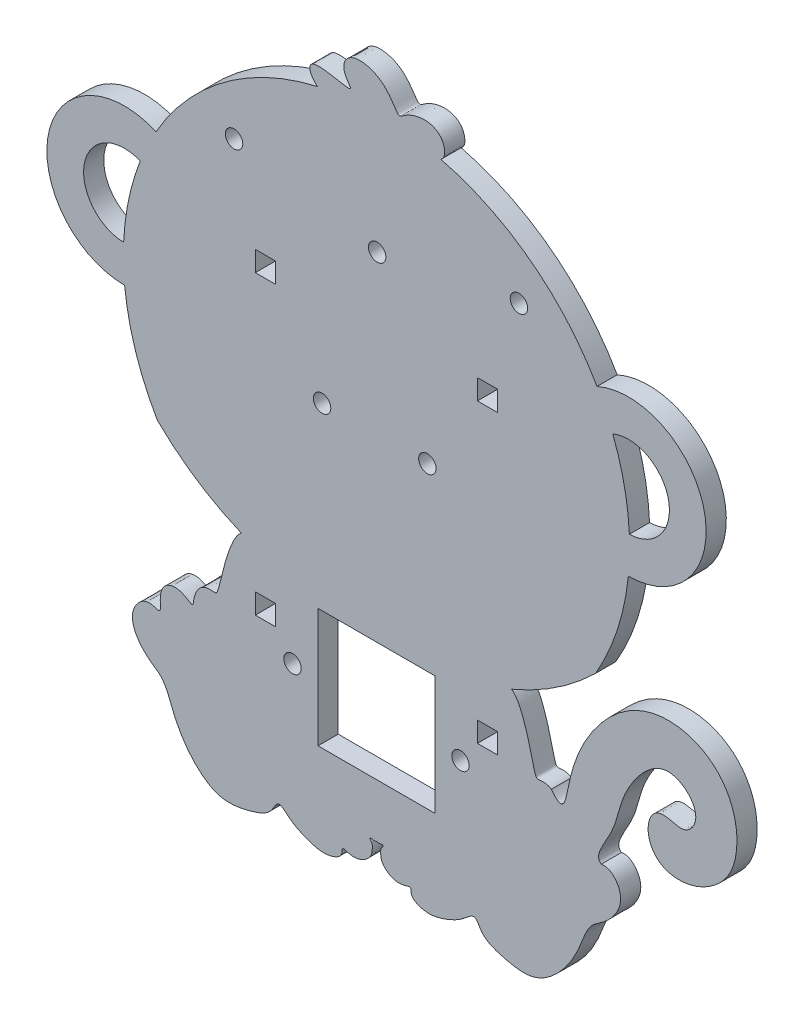
from build123d import *

# Parameters (mm, degrees)
MODEL_R             = 2.05
MODEL_W             = 4.75
MODEL_H             = 4.75
BOSS_EXTRUDE1_DEPTH = 4.75


with BuildPart() as part:
    # Model → Boss-Extrude1 (new body)
    # profile 1 of 10: a face of its own
    with BuildSketch(Plane.XY):
        with BuildLine():
            ThreePointArc((-295.53920269, 433.095020448), (-282.608650806, 438.430402071), (-277.24978825, 451.351240325))
            ThreePointArc((-277.24978825, 451.351240325), (-285.554772518, 466.656892039), (-302.913653982, 468.037099404))
            ThreePointArc((-302.913653982, 468.037099404), (-300.915846738, 464.202061949), (-299.205795948, 460.23035295))
            ThreePointArc((-299.205795948, 460.23035295), (-290.170377358, 459.354837696), (-285.886950557, 451.351240325))
            ThreePointArc((-285.886950557, 451.351240325), (-288.632642257, 444.621955402), (-295.302245857, 441.734311673))
            ThreePointArc((-295.302245857, 441.734311673), (-295.261502258, 437.410298949), (-295.53920269, 433.095020448))
        make_face()
    # profile 2 of 10: a face of its own
    with BuildSketch(Plane.XY):
        with BuildLine():
            ThreePointArc((-299.205795948, 460.23035295), (-300.915846738, 464.202061949), (-302.913653982, 468.037099404))
            ThreePointArc((-302.913653982, 468.037099404), (-313.368807432, 447.58134096), (-295.53920269, 433.095020448))
            ThreePointArc((-295.53920269, 433.095020448), (-295.261502258, 437.410298949), (-295.302245857, 441.734311673))
            ThreePointArc((-295.302245857, 441.734311673), (-304.917803711, 449.364907283), (-299.205795948, 460.23035295))
        make_face()
    # profile 3 of 10: a face of its own
    with BuildSketch(Plane.XY):
        with BuildLine():
            ThreePointArc((-295.53920269, 433.095020448), (-313.368807432, 447.58134096), (-302.913653982, 468.037099404))
            ThreePointArc((-302.913653982, 468.037099404), (-318.490243046, 485.80537303), (-339.811140885, 495.991686882))
            ThreePointArc((-339.811140885, 495.991686882), (-347.238992057, 497.333297382), (-354.777593989, 497.710620444))
            ThreePointArc((-354.777593989, 497.710620444), (-361.756537627, 497.394857379), (-368.648535438, 496.252173352))
            ThreePointArc((-368.648535438, 496.252173352), (-390.614540969, 486.143224047), (-406.641533995, 468.037099404))
            ThreePointArc((-406.641533995, 468.037099404), (-398.743498013, 461.302506057), (-395.792899727, 451.351240325))
            ThreePointArc((-395.792899727, 451.351240325), (-401.128311473, 438.453852881), (-414.015985287, 433.095020448))
            ThreePointArc((-414.015985287, 433.095020448), (-411.431056442, 420.844790734), (-406.306877408, 409.421447336))
            ThreePointArc((-406.306877408, 409.421447336), (-397.05642145, 401.927835806), (-386.551251239, 396.327251189))
            ThreePointArc((-386.551251239, 396.327251189), (-370.945172765, 392.102760227), (-354.777593989, 392.029236712))
            ThreePointArc((-354.777593989, 392.029236712), (-338.610015212, 392.102760227), (-323.003936738, 396.327251189))
            ThreePointArc((-323.003936738, 396.327251189), (-312.498766528, 401.927835806), (-303.24831057, 409.421447336))
            ThreePointArc((-303.24831057, 409.421447336), (-298.124131535, 420.844790734), (-295.53920269, 433.095020448))
        make_face()
        with Locations((-367.578065783, 432.289888386)):
            Circle(MODEL_R, mode=Mode.SUBTRACT)
        with Locations((-380.902593989, 453.404236712)):
            Rectangle(MODEL_W, MODEL_H, mode=Mode.SUBTRACT)
        with Locations((-388.277593989, 475.779236712)):
            Circle(MODEL_R, mode=Mode.SUBTRACT)
        with Locations((-354.619244966, 469.543613637)):
            Circle(MODEL_R, mode=Mode.SUBTRACT)
        with Locations((-342.813199123, 432.371155303)):
            Circle(MODEL_R, mode=Mode.SUBTRACT)
        with Locations((-328.652593989, 453.404236712)):
            Rectangle(MODEL_W, MODEL_H, mode=Mode.SUBTRACT)
        with Locations((-321.277593989, 475.779236712)):
            Circle(MODEL_R, mode=Mode.SUBTRACT)
    # profile 4 of 10: a face of its own
    with BuildSketch(Plane.XY):
        with BuildLine():
            ThreePointArc((-295.302245857, 441.734311673), (-296.504545624, 451.140507471), (-299.205795948, 460.23035295))
            ThreePointArc((-299.205795948, 460.23035295), (-304.917803711, 449.364907283), (-295.302245857, 441.734311673))
        make_face()
    # profile 5 of 10: a face of its own
    with BuildSketch(Plane.XY):
        with BuildLine():
            ThreePointArc((-354.777593989, 497.710620444), (-347.238992057, 497.333297382), (-339.811140885, 495.991686882))
            add(Edge.make_bspline(
                [(-368.648535438, 496.252173352), (-368.744458236, 496.318852064), (-368.933155722, 496.46135137), (-369.206763211, 496.702529524), (-369.552638711, 497.078952875), (-369.945448044, 497.635151945), (-370.27396009, 498.258937778), (-370.49029081, 498.914952019), (-370.51070775, 499.541563445), (-370.238365938, 500.064302422), (-369.5990972, 500.417471707), (-368.57162488, 500.562380095), (-367.22355688, 500.508813977), (-365.687080465, 500.304348965), (-364.130399482, 500.021394498), (-362.730437113, 499.744991582), (-361.645780778, 499.560560003), (-360.987783845, 499.541133492), (-360.796409046, 499.736067669), (-361.003653893, 500.155847055), (-361.456239643, 500.775355547), (-361.969645158, 501.546412025), (-362.368346783, 502.406968262), (-362.540769792, 503.292531993), (-362.454363932, 504.143316727), (-362.127001431, 504.906996063), (-361.609010526, 505.54285956), (-360.962354705, 506.024792223), (-360.237689537, 506.346315269), (-359.465109655, 506.519028644), (-358.662050204, 506.563781119), (-357.836770513, 506.503364206), (-356.993360104, 506.355416269), (-356.136711355, 506.123246396), (-355.27524615, 505.794703449), (-354.419874931, 505.352916652), (-353.583850229, 504.783872945), (-352.782377599, 504.085819177), (-352.032065864, 503.276653785), (-351.351103862, 502.405268117), (-350.756796891, 501.550400765), (-350.259062752, 500.800910062), (-349.854900796, 500.240489256), (-349.52240587, 499.930593307), (-349.215031159, 499.894076524), (-348.855526802, 500.098537748), (-348.362085472, 500.475509867), (-347.67170771, 500.938251599), (-346.770031422, 501.402187782), (-345.688786994, 501.792289415), (-344.48987856, 502.045099565), (-343.253856136, 502.112491058), (-342.066559862, 501.964757688), (-341.006667622, 501.593968073), (-340.132609258, 501.01739116), (-339.470394525, 500.280534755), (-339.021946768, 499.447136213), (-338.772548612, 498.589873373), (-338.698846344, 497.780410896), (-338.775989921, 497.080683391), (-338.986639614, 496.531262609), (-339.255348506, 496.227388525), (-339.511863577, 496.0787419), (-339.707309513, 496.014838841), (-339.811140885, 495.991686882)],
                knots=[0, 0, 0, 0, 0, 0, 0.016666667, 0.033333333, 0.05, 0.066666667, 0.083333333, 0.1, 0.116666667, 0.133333333, 0.15, 0.166666667, 0.183333333, 0.2, 0.216666667, 0.233333333, 0.25, 0.266666667, 0.283333333, 0.3, 0.316666667, 0.333333333, 0.35, 0.366666667, 0.383333333, 0.4, 0.416666667, 0.433333333, 0.45, 0.466666667, 0.483333333, 0.5, 0.516666667, 0.533333333, 0.55, 0.566666667, 0.583333333, 0.6, 0.616666667, 0.633333333, 0.65, 0.666666667, 0.683333333, 0.7, 0.716666667, 0.733333333, 0.75, 0.766666667, 0.783333333, 0.8, 0.816666667, 0.833333333, 0.85, 0.866666667, 0.883333333, 0.9, 0.916666667, 0.933333333, 0.95, 0.966666667, 0.983333333, 1, 1, 1, 1, 1, 1], degree=5))
            ThreePointArc((-368.648535438, 496.252173352), (-361.756537627, 497.394857379), (-354.777593989, 497.710620444))
        make_face()
    # profile 6 of 10: a face of its own
    with BuildSketch(Plane.XY):
        with BuildLine():
            add(Edge.make_bspline(
                [(-323.003936738, 396.327251189), (-322.639135583, 396.079204413), (-322.18920374, 395.634433922), (-321.658390696, 394.898644088), (-321.051857816, 393.757203334), (-320.383735374, 392.131003368), (-319.977262023, 391.014654975), (-319.584917193, 389.819275468), (-319.135868658, 388.323421516), (-318.721860717, 386.804935246), (-318.353600889, 385.34636593), (-318.038508773, 384.035346949), (-317.773489578, 382.944281063), (-317.579832511, 382.209449772), (-317.401157087, 381.664820315), (-317.218450591, 381.31109681), (-317.003689416, 381.129911234), (-316.721708308, 381.082225409), (-316.343707995, 381.115525432), (-315.861762853, 381.169472404), (-315.293993546, 381.182617586), (-314.716438841, 381.105097359), (-314.256472836, 380.951412883), (-313.932453608, 380.783648044), (-313.737120758, 380.657216991), (-313.6607794, 380.60362174)],
                knots=[0, 0, 0, 0, 0, 0, 0.02, 0.025, 0.03, 0.035, 0.04, 0.045, 0.05, 0.06, 0.065, 0.07, 0.075, 0.08, 0.085, 0.09, 0.095, 0.1, 0.105, 0.11, 0.115, 0.12, 0.123294018, 0.123294018, 0.123294018, 0.123294018, 0.123294018, 0.123294018], degree=5))
            ThreePointArc((-323.003936738, 396.327251189), (-338.610015212, 392.102760227), (-354.777593989, 392.029236712))
            ThreePointArc((-354.777593989, 392.029236712), (-370.945172765, 392.102760227), (-386.551251239, 396.327251189))
            add(Edge.make_bspline(
                [(-386.551251239, 396.327251189), (-386.916052394, 396.079204413), (-387.365984237, 395.634433922), (-387.896797281, 394.898644088), (-388.503330161, 393.757203334), (-389.171452603, 392.131003368), (-389.577925954, 391.014654975), (-389.970270784, 389.819275468), (-390.419319319, 388.323421516), (-390.83332726, 386.804935246), (-391.201587088, 385.34636593), (-391.516679205, 384.035346949), (-391.781698399, 382.944281063), (-391.975355466, 382.209449772), (-392.15403089, 381.664820315), (-392.336737386, 381.31109681), (-392.551498562, 381.129911234), (-392.833479669, 381.082225409), (-393.211479982, 381.115525432), (-393.693425125, 381.169472404), (-394.261194431, 381.182617586), (-394.881047474, 381.099420015), (-395.510435114, 380.877573231), (-396.105936728, 380.494485307), (-396.631517428, 379.95585235), (-397.063963964, 379.297531395), (-397.39210439, 378.573969962), (-397.617276013, 377.849585475), (-397.753517497, 377.188797135), (-397.82736951, 376.647023839), (-397.879059879, 376.260334721), (-397.959633552, 376.038465419), (-398.114782848, 375.972462073), (-398.366034123, 376.040823891), (-398.706936261, 376.21469148), (-399.120091801, 376.460086445), (-399.591458011, 376.741171495), (-400.117952431, 377.022315753), (-400.699774201, 377.268862798), (-401.463798734, 377.484035353), (-402.300244633, 377.553822048), (-403.174091852, 377.426716269), (-404.002173047, 377.065864722), (-404.698224792, 376.46441147), (-405.153470998, 375.811835942), (-405.461269956, 375.032169593), (-405.619922332, 374.166940367), (-405.657953521, 373.27889911), (-405.626485489, 372.442499072), (-405.587522811, 371.731075977), (-405.603727217, 371.205296174), (-405.727364814, 370.900755869), (-405.990085682, 370.81668236), (-406.39105056, 370.902146782), (-406.905602715, 371.07475403), (-407.496249881, 371.243305804), (-408.122207542, 371.327500075), (-408.751072773, 371.282728006), (-409.35960202, 371.097539496), (-409.931191749, 370.782809916), (-410.454421679, 370.36348433), (-410.921225043, 369.869653892), (-411.325051593, 369.32694511), (-411.659572418, 368.750331411), (-411.919102239, 368.147846593), (-412.098696202, 367.522400938), (-412.194371621, 366.874422897), (-412.203287138, 366.20397783), (-412.092164868, 365.237355517), (-411.795780763, 364.240492853), (-411.25356719, 363.0979097), (-410.505546493, 362.004000685), (-409.628552466, 361.020862692), (-408.940714048, 360.363039305), (-408.261699769, 359.795455705), (-407.719269628, 359.383631865), (-407.21381394, 359.028246689), (-406.753242924, 358.71792316), (-406.337217025, 358.432587935), (-405.958407604, 358.146100067), (-405.606436892, 357.832150323), (-405.270933307, 357.469037169), (-404.945150571, 357.045248498), (-404.628769556, 356.563710073), (-404.325203667, 356.036561227), (-404.039420225, 355.480831591), (-403.775511082, 354.913678765), (-403.486293011, 354.234906798), (-403.22438966, 353.563780813), (-402.971971356, 352.893055429), (-402.704512752, 352.203026621), (-402.401681187, 351.478012783), (-402.062584898, 350.721085445), (-401.674639208, 349.927966936), (-401.239024686, 349.111007443), (-400.763113802, 348.289788183), (-400.254340005, 347.481959495), (-399.722634495, 346.692998852), (-399.163365939, 345.932140679), (-398.574323946, 345.19923963), (-397.949478676, 344.488835597), (-397.28186749, 343.797089708), (-396.693729261, 343.232918759), (-395.94666487, 342.573889335), (-395.145878925, 341.947793479), (-394.290902186, 341.375211916), (-393.384167186, 340.882126765), (-392.430043668, 340.491703263), (-391.606002687, 340.243986907), (-390.756002743, 340.079446261), (-389.883129061, 339.998262902), (-388.990604918, 339.995014447), (-388.082210988, 340.060658996), (-387.162607569, 340.183979577), (-386.237707408, 340.353267946), (-385.315001235, 340.557855636), (-384.403963907, 340.789827334), (-383.516286063, 341.045384095), (-382.66652457, 341.327024633), (-381.871318875, 341.642937555), (-381.146754324, 342.002777686), (-380.506140062, 342.414272763), (-379.957720387, 342.879646699), (-379.50217975, 343.391768319), (-379.130782998, 343.931240964), (-378.821858803, 344.461005534), (-378.544703377, 344.932108886), (-378.267774642, 345.29593373), (-377.965518245, 345.51436395), (-377.625879138, 345.570992742), (-377.257148561, 345.481328236), (-376.875804119, 345.278776475), (-376.496250149, 345.00253689), (-376.11706805, 344.682307942), (-375.720845967, 344.335154988), (-375.283150649, 343.970625574), (-374.779103973, 343.593551859), (-374.190278948, 343.207542556), (-373.377688666, 342.741091189), (-372.449841911, 342.284943077), (-371.448923671, 341.861784637), (-370.434447105, 341.496921291), (-369.457107924, 341.211628122), (-368.685864943, 341.035221995), (-367.964373903, 340.924859402), (-367.285516994, 340.881136877), (-366.635919607, 340.902071878), (-366.001452121, 340.984188477), (-365.373937537, 341.123915256), (-364.75630659, 341.318535957), (-364.170945702, 341.568094094), (-363.657947564, 341.87428189), (-363.258368215, 342.235110671), (-362.999601239, 342.639822419), (-362.882834785, 343.065290294), (-362.862380856, 343.467877411), (-362.860328863, 343.794256059), (-362.800804618, 344.002021381), (-362.645316427, 344.082202864), (-362.403915174, 344.064482859), (-362.091030238, 343.983757423), (-361.712216892, 343.868949898), (-361.271123238, 343.746963048), (-360.772201451, 343.643387937), (-360.225145899, 343.584551667), (-359.643851104, 343.593953505), (-359.045609545, 343.68889199), (-358.331130904, 343.914571841), (-357.653031997, 344.271758954), (-357.055699253, 344.71601695), (-356.577458743, 345.17871164), (-356.233391408, 345.621031596), (-356.033125086, 345.975351534), (-355.902737419, 346.342883089), (-355.820827463, 346.757252518), (-355.769760706, 347.236551212), (-355.745106949, 347.759570584), (-355.762413964, 348.248781386), (-355.838587496, 348.623368474), (-355.977712536, 348.837568218), (-356.150848594, 348.941800594), (-356.292732028, 349.075710758), (-356.33646563, 349.288102762), (-356.236344626, 349.443149765), (-355.997125235, 349.455364951), (-355.677539018, 349.382302231), (-355.345578077, 349.318848286), (-355.1000792, 349.319880609), (-354.932396923, 349.356987082), (-354.827970147, 349.397996872), (-354.777593989, 349.422562594)],
                knots=[0, 0, 0, 0, 0, 0, 0.02, 0.025, 0.03, 0.035, 0.04, 0.045, 0.05, 0.06, 0.065, 0.07, 0.075, 0.08, 0.085, 0.09, 0.095, 0.1, 0.105, 0.11, 0.115, 0.12, 0.125, 0.13, 0.135, 0.14, 0.145, 0.15, 0.155, 0.16, 0.165, 0.17, 0.175, 0.18, 0.185, 0.19, 0.195, 0.2, 0.205, 0.21, 0.22, 0.225, 0.23, 0.235, 0.24, 0.245, 0.25, 0.255, 0.26, 0.265, 0.27, 0.275, 0.28, 0.285, 0.29, 0.295, 0.3, 0.305, 0.31, 0.315, 0.32, 0.325, 0.33, 0.335, 0.34, 0.345, 0.35, 0.355, 0.36, 0.375, 0.38, 0.39, 0.395, 0.4, 0.405, 0.41, 0.415, 0.42, 0.425, 0.43, 0.435, 0.44, 0.445, 0.45, 0.455, 0.46, 0.465, 0.47, 0.48, 0.485, 0.49, 0.495, 0.5, 0.51, 0.515, 0.52, 0.525, 0.53, 0.54, 0.545, 0.55, 0.555, 0.56, 0.565, 0.575, 0.58, 0.585, 0.59, 0.595, 0.6, 0.605, 0.61, 0.615, 0.62, 0.625, 0.63, 0.635, 0.64, 0.645, 0.65, 0.655, 0.66, 0.665, 0.67, 0.675, 0.68, 0.685, 0.69, 0.695, 0.7, 0.705, 0.71, 0.715, 0.72, 0.725, 0.73, 0.735, 0.74, 0.745, 0.755, 0.76, 0.765, 0.77, 0.775, 0.78, 0.785, 0.79, 0.795, 0.8, 0.805, 0.81, 0.815, 0.82, 0.825, 0.83, 0.835, 0.84, 0.845, 0.85, 0.855, 0.86, 0.865, 0.87, 0.875, 0.88, 0.885, 0.89, 0.895, 0.905, 0.91, 0.915, 0.92, 0.925, 0.93, 0.935, 0.94, 0.945, 0.95, 0.955, 0.96, 0.965, 0.97, 0.975, 0.98, 0.985, 0.99, 0.995, 1, 1, 1, 1, 1, 1], degree=5))
            add(Edge.make_bspline(
                [(-301.898947089, 371.249991702), (-301.80670497, 371.265018138), (-301.589974955, 371.293910279), (-301.244905456, 371.313674079), (-300.773941346, 371.273545454), (-300.195585957, 371.097539496), (-299.623996228, 370.782809916), (-299.100766299, 370.36348433), (-298.633962934, 369.869653892), (-298.230136384, 369.32694511), (-297.89561556, 368.750331411), (-297.636085738, 368.147846593), (-297.456491776, 367.522400938), (-297.360816357, 366.874422897), (-297.35190084, 366.20397783), (-297.463023109, 365.237355517), (-297.759407215, 364.240492853), (-298.301620787, 363.0979097), (-299.049641484, 362.004000685), (-299.926635511, 361.020862692), (-300.61447393, 360.363039305), (-301.293488209, 359.795455705), (-301.83591835, 359.383631865), (-302.341374037, 359.028246689), (-302.801945054, 358.71792316), (-303.217970952, 358.432587935), (-303.596780374, 358.146100067), (-303.948751085, 357.832150323), (-304.28425467, 357.469037169), (-304.610037406, 357.045248498), (-304.926418421, 356.563710073), (-305.22998431, 356.036561227), (-305.515767753, 355.480831591), (-305.779676896, 354.913678765), (-306.068894967, 354.234906798), (-306.330798317, 353.563780813), (-306.583216622, 352.893055429), (-306.850675225, 352.203026621), (-307.15350679, 351.478012783), (-307.492603079, 350.721085445), (-307.88054877, 349.927966936), (-308.316163291, 349.111007443), (-308.792074176, 348.289788183), (-309.300847972, 347.481959495), (-309.832553482, 346.692998852), (-310.391822039, 345.932140679), (-310.980864031, 345.19923963), (-311.605709301, 344.488835597), (-312.273320488, 343.797089708), (-312.861458716, 343.232918759), (-313.608523108, 342.573889335), (-314.409309053, 341.947793479), (-315.264285791, 341.375211916), (-316.171020791, 340.882126765), (-317.125144309, 340.491703263), (-317.949185291, 340.243986907), (-318.799185234, 340.079446261), (-319.672058916, 339.998262902), (-320.564583059, 339.995014447), (-321.472976989, 340.060658996), (-322.392580408, 340.183979577), (-323.31748057, 340.353267946), (-324.240186742, 340.557855636), (-325.151224071, 340.789827334), (-326.038901914, 341.045384095), (-326.888663407, 341.327024633), (-327.683869103, 341.642937555), (-328.408433654, 342.002777686), (-329.049047915, 342.414272763), (-329.59746759, 342.879646699), (-330.053008227, 343.391768319), (-330.42440498, 343.931240964), (-330.733329174, 344.461005534), (-331.0104846, 344.932108886), (-331.287413335, 345.29593373), (-331.589669732, 345.51436395), (-331.929308839, 345.570992742), (-332.298039416, 345.481328236), (-332.679383858, 345.278776475), (-333.058937829, 345.00253689), (-333.438119927, 344.682307942), (-333.83434201, 344.335154988), (-334.272037329, 343.970625574), (-334.776084004, 343.593551859), (-335.364909029, 343.207542556), (-336.177499311, 342.741091189), (-337.105346067, 342.284943077), (-338.106264306, 341.861784637), (-339.120740873, 341.496921291), (-340.098080053, 341.211628122), (-340.869323035, 341.035221995), (-341.590814074, 340.924859402), (-342.269670984, 340.881136877), (-342.91926837, 340.902071878), (-343.553735856, 340.984188477), (-344.18125044, 341.123915256), (-344.798881387, 341.318535957), (-345.384242276, 341.568094094), (-345.897240413, 341.87428189), (-346.296819762, 342.235110671), (-346.555586738, 342.639822419), (-346.672353193, 343.065290294), (-346.692807122, 343.467877411), (-346.694859114, 343.794256059), (-346.754383359, 344.002021381), (-346.909871551, 344.082202864), (-347.151272803, 344.064482859), (-347.46415774, 343.983757423), (-347.842971085, 343.868949898), (-348.284064739, 343.746963048), (-348.782986526, 343.643387937), (-349.330042079, 343.584551667), (-349.911336873, 343.593953505), (-350.509578433, 343.68889199), (-351.224057074, 343.914571841), (-351.902155981, 344.271758954), (-352.499488725, 344.71601695), (-352.977729235, 345.17871164), (-353.321796569, 345.621031596), (-353.522062892, 345.975351534), (-353.652450559, 346.342883089), (-353.734360514, 346.757252518), (-353.785427271, 347.236551212), (-353.810081029, 347.759570584), (-353.792774013, 348.248781386), (-353.716600481, 348.623368474), (-353.577475441, 348.837568218), (-353.404339383, 348.941800594), (-353.262455949, 349.075710758), (-353.218722348, 349.288102762), (-353.318843352, 349.443149765), (-353.558062742, 349.455364951), (-353.87764896, 349.382302231), (-354.2096099, 349.318848286), (-354.455108777, 349.319880609), (-354.622791055, 349.356987082), (-354.727217831, 349.397996872), (-354.777593989, 349.422562594)],
                knots=[0.291239622, 0.291239622, 0.291239622, 0.291239622, 0.291239622, 0.291239622, 0.295, 0.3, 0.305, 0.31, 0.315, 0.32, 0.325, 0.33, 0.335, 0.34, 0.345, 0.35, 0.355, 0.36, 0.375, 0.38, 0.39, 0.395, 0.4, 0.405, 0.41, 0.415, 0.42, 0.425, 0.43, 0.435, 0.44, 0.445, 0.45, 0.455, 0.46, 0.465, 0.47, 0.48, 0.485, 0.49, 0.495, 0.5, 0.51, 0.515, 0.52, 0.525, 0.53, 0.54, 0.545, 0.55, 0.555, 0.56, 0.565, 0.575, 0.58, 0.585, 0.59, 0.595, 0.6, 0.605, 0.61, 0.615, 0.62, 0.625, 0.63, 0.635, 0.64, 0.645, 0.65, 0.655, 0.66, 0.665, 0.67, 0.675, 0.68, 0.685, 0.69, 0.695, 0.7, 0.705, 0.71, 0.715, 0.72, 0.725, 0.73, 0.735, 0.74, 0.745, 0.755, 0.76, 0.765, 0.77, 0.775, 0.78, 0.785, 0.79, 0.795, 0.8, 0.805, 0.81, 0.815, 0.82, 0.825, 0.83, 0.835, 0.84, 0.845, 0.85, 0.855, 0.86, 0.865, 0.87, 0.875, 0.88, 0.885, 0.89, 0.895, 0.905, 0.91, 0.915, 0.92, 0.925, 0.93, 0.935, 0.94, 0.945, 0.95, 0.955, 0.96, 0.965, 0.97, 0.975, 0.98, 0.985, 0.99, 0.995, 1, 1, 1, 1, 1, 1], degree=5))
            add(Edge.make_bspline(
                [(-312.570027786, 379.374371389), (-312.559271777, 379.355886568), (-312.470544427, 379.20149493), (-312.316103558, 378.902890391), (-312.124199573, 378.448878813), (-311.937911965, 377.849585475), (-311.80167048, 377.188797135), (-311.727818467, 376.647023839), (-311.676128098, 376.260334721), (-311.595554426, 376.038465419), (-311.440405129, 375.972462073), (-311.189153854, 376.040823891), (-310.848251716, 376.21469148), (-310.435096176, 376.460086445), (-309.963729966, 376.741171495), (-309.437235546, 377.022315753), (-308.855413777, 377.268862798), (-308.091389244, 377.484035353), (-307.254943345, 377.553822048), (-306.381096125, 377.426716269), (-305.55301493, 377.065864722), (-304.856963186, 376.46441147), (-304.401716979, 375.811835942), (-304.093918022, 375.032169593), (-303.935265645, 374.166940367), (-303.897234456, 373.27889911), (-303.928702489, 372.442499072), (-303.967665167, 371.731075977), (-303.951460761, 371.205296174), (-303.827823164, 370.900755869), (-303.565102295, 370.81668236), (-303.164137417, 370.902146782), (-302.726981679, 371.048791293), (-302.352600007, 371.158775291), (-302.081981557, 371.218669096), (-301.929355044, 371.245038182), (-301.898947089, 371.249991702)],
                knots=[0.134317153, 0.134317153, 0.134317153, 0.134317153, 0.134317153, 0.134317153, 0.135, 0.14, 0.145, 0.15, 0.155, 0.16, 0.165, 0.17, 0.175, 0.18, 0.185, 0.19, 0.195, 0.2, 0.205, 0.21, 0.22, 0.225, 0.23, 0.235, 0.24, 0.245, 0.25, 0.255, 0.26, 0.265, 0.27, 0.275, 0.28, 0.285, 0.29, 0.291239622, 0.291239622, 0.291239622, 0.291239622, 0.291239622, 0.291239622], degree=5))
            add(Edge.make_bspline(
                [(-313.6607794, 380.60362174), (-313.444699739, 380.320105618), (-313.214558019, 380.036320029), (-312.995336379, 379.78705437), (-312.787038261, 379.572315107), (-312.589582176, 379.391986634), (-312.570027786, 379.374371389)],
                knots=[0, 0, 0, 0, 0, 0, 0.01, 0.011105874, 0.011105874, 0.011105874, 0.011105874, 0.011105874, 0.011105874], degree=5))
        make_face()
        with Locations((-374.527593989, 375.779236712)):
            Circle(MODEL_R, mode=Mode.SUBTRACT)
        Polygon((-368.527593989, 362.029236712), (-368.527593989, 390.029236712), (-354.777593989, 390.029236712), (-341.027593989, 390.029236712), (-341.027593989, 362.029236712), (-354.777593989, 362.029236712), align=None, mode=Mode.SUBTRACT)
        with Locations((-380.902593989, 383.654236712)):
            Rectangle(MODEL_W, MODEL_H, mode=Mode.SUBTRACT)
        with Locations((-335.027593989, 375.779236712)):
            Circle(MODEL_R, mode=Mode.SUBTRACT)
        with Locations((-328.652593989, 383.654236712)):
            Rectangle(MODEL_W, MODEL_H, mode=Mode.SUBTRACT)
    # profile 7 of 10: a face of its own
    with BuildSketch(Plane.XY):
        with BuildLine():
            ThreePointArc((-410.349392029, 460.23035295), (-408.639341239, 464.202061949), (-406.641533995, 468.037099404))
            ThreePointArc((-406.641533995, 468.037099404), (-431.911918909, 455.12113969), (-414.015985287, 433.095020448))
            ThreePointArc((-414.015985287, 433.095020448), (-414.293685719, 437.410298949), (-414.252942121, 441.734311673))
            ThreePointArc((-414.252942121, 441.734311673), (-423.460915188, 453.337573366), (-410.349392029, 460.23035295))
        make_face()
    # profile 8 of 10: a face of its own
    with BuildSketch(Plane.XY):
        with BuildLine():
            ThreePointArc((-395.792899727, 451.351240325), (-398.743498013, 461.302506057), (-406.641533995, 468.037099404))
            ThreePointArc((-406.641533995, 468.037099404), (-408.639341239, 464.202061949), (-410.349392029, 460.23035295))
            ThreePointArc((-410.349392029, 460.23035295), (-406.045552356, 456.686901216), (-404.430062035, 451.351240325))
            ThreePointArc((-404.430062035, 451.351240325), (-407.319864805, 444.477844332), (-414.252942121, 441.734311673))
            ThreePointArc((-414.252942121, 441.734311673), (-414.293685719, 437.410298949), (-414.015985287, 433.095020448))
            ThreePointArc((-414.015985287, 433.095020448), (-401.128311473, 438.453852881), (-395.792899727, 451.351240325))
        make_face()
    # profile 9 of 10: a face of its own
    with BuildSketch(Plane.XY):
        with BuildLine():
            ThreePointArc((-404.430062035, 451.351240325), (-406.045552356, 456.686901216), (-410.349392029, 460.23035295))
            ThreePointArc((-410.349392029, 460.23035295), (-413.050642353, 451.140507471), (-414.252942121, 441.734311673))
            ThreePointArc((-414.252942121, 441.734311673), (-407.319864805, 444.477844332), (-404.430062035, 451.351240325))
        make_face()
    # profile 10 of 10: a face of its own
    with BuildSketch(Plane.XY):
        with BuildLine():
            add(Edge.make_bspline(
                [(-312.570027786, 379.374371389), (-312.412759184, 379.232698603), (-312.093427145, 378.978603713), (-311.652711141, 378.741820379), (-311.154948108, 378.73190092), (-310.673366326, 379.216827317), (-310.292721218, 380.178229359), (-309.968617434, 381.523898785), (-309.640561499, 383.162221439), (-309.250925564, 385.001542652), (-308.755268533, 386.963327702), (-308.001652746, 389.39378453), (-307.030109551, 391.853114628), (-305.836320205, 394.276384281), (-304.437971019, 396.623488316), (-302.855961089, 398.859622636), (-301.423227661, 400.629872898), (-299.570759796, 402.614165823), (-297.55376872, 404.384775694), (-295.374305071, 405.888080142), (-292.650761978, 407.269272218), (-289.32996603, 408.269637229), (-286.299006859, 408.594090842), (-283.265109328, 408.344541641), (-280.379149882, 407.539092006), (-278.092782759, 406.4785487), (-276.348901152, 405.366769995), (-274.485083983, 403.787796033), (-272.937052277, 401.94602382), (-271.727774145, 399.906931327), (-270.857132325, 397.745077765), (-270.306480744, 395.538773505), (-270.046205794, 393.710009769), (-269.965016257, 391.930118455), (-270.040978563, 390.2346489), (-270.252293644, 388.652401735), (-270.579877607, 387.201933377), (-271.009722971, 385.888830428), (-271.535866394, 384.70099922), (-272.161214125, 383.610945588), (-272.895776168, 382.586894991), (-273.755463023, 381.601444913), (-274.760882323, 380.641693853), (-275.93548394, 379.717384281), (-277.297305988, 378.856918007), (-278.851525965, 378.104383008), (-280.582328457, 377.516407907), (-282.445893609, 377.158636255), (-284.360670175, 377.103581142), (-286.219105708, 377.4170411), (-287.903220924, 378.142688713), (-289.299028152, 379.286710653), (-290.311010342, 380.803687119), (-290.877596402, 382.578851159), (-290.983205819, 384.420926362), (-290.650627543, 386.112012698), (-289.935960884, 387.451354667), (-288.922339625, 388.299673225), (-287.714778317, 388.627521421), (-286.432799241, 388.549506411), (-285.187617596, 388.257647228), (-284.061898655, 387.966698541), (-283.086509475, 387.852497186), (-282.224227316, 388.000042889), (-281.424791372, 388.432592409), (-280.672983329, 389.134306182), (-280.042701572, 390.076155472), (-279.651481692, 391.214486489), (-279.614594112, 392.489509944), (-279.993445178, 393.822748232), (-280.76403377, 395.118025382), (-281.851079655, 396.27377504), (-283.152043236, 397.193839546), (-284.562929688, 397.798008073), (-286.008600232, 398.034757091), (-287.450506474, 397.88487723), (-288.870633099, 397.355559995), (-290.261394711, 396.477163759), (-291.614267711, 395.298727975), (-292.906052001, 393.884476201), (-294.101045993, 392.307630147), (-295.162040147, 390.642897503), (-296.05819531, 388.959584105), (-296.774951218, 387.313965856), (-297.321372994, 385.743083541), (-297.742815902, 384.255163919), (-298.11469187, 382.832378816), (-298.518808306, 381.445147803), (-299.023340821, 380.063869225), (-299.663776374, 378.670412259), (-300.417430607, 377.272852531), (-301.203239072, 375.907021068), (-301.910810817, 374.622658725), (-302.422921716, 373.473093417), (-302.638326758, 372.504569396), (-302.527935786, 371.895313524), (-302.278358106, 371.535036125), (-302.03777992, 371.337842664), (-301.898947089, 371.249991702)],
                knots=[0.011105874, 0.011105874, 0.011105874, 0.011105874, 0.011105874, 0.011105874, 0.02, 0.03, 0.04, 0.05, 0.06, 0.07, 0.08, 0.09, 0.1, 0.11, 0.13, 0.14, 0.15, 0.16, 0.17, 0.18, 0.2, 0.21, 0.22, 0.24, 0.26, 0.27, 0.28, 0.29, 0.3, 0.31, 0.33, 0.34, 0.35, 0.36, 0.37, 0.38, 0.39, 0.4, 0.41, 0.42, 0.43, 0.44, 0.45, 0.46, 0.47, 0.48, 0.49, 0.5, 0.51, 0.52, 0.53, 0.54, 0.55, 0.56, 0.57, 0.58, 0.59, 0.6, 0.61, 0.62, 0.63, 0.64, 0.65, 0.66, 0.67, 0.68, 0.69, 0.7, 0.71, 0.72, 0.73, 0.74, 0.75, 0.76, 0.77, 0.78, 0.79, 0.8, 0.81, 0.82, 0.83, 0.84, 0.85, 0.86, 0.87, 0.88, 0.89, 0.9, 0.91, 0.92, 0.93, 0.94, 0.95, 0.96, 0.97, 0.98, 0.99, 1, 1, 1, 1, 1, 1], degree=5))
            add(Edge.make_bspline(
                [(-312.570027786, 379.374371389), (-312.559271777, 379.355886568), (-312.470544427, 379.20149493), (-312.316103558, 378.902890391), (-312.124199573, 378.448878813), (-311.937911965, 377.849585475), (-311.80167048, 377.188797135), (-311.727818467, 376.647023839), (-311.676128098, 376.260334721), (-311.595554426, 376.038465419), (-311.440405129, 375.972462073), (-311.189153854, 376.040823891), (-310.848251716, 376.21469148), (-310.435096176, 376.460086445), (-309.963729966, 376.741171495), (-309.437235546, 377.022315753), (-308.855413777, 377.268862798), (-308.091389244, 377.484035353), (-307.254943345, 377.553822048), (-306.381096125, 377.426716269), (-305.55301493, 377.065864722), (-304.856963186, 376.46441147), (-304.401716979, 375.811835942), (-304.093918022, 375.032169593), (-303.935265645, 374.166940367), (-303.897234456, 373.27889911), (-303.928702489, 372.442499072), (-303.967665167, 371.731075977), (-303.951460761, 371.205296174), (-303.827823164, 370.900755869), (-303.565102295, 370.81668236), (-303.164137417, 370.902146782), (-302.726981679, 371.048791293), (-302.352600007, 371.158775291), (-302.081981557, 371.218669096), (-301.929355044, 371.245038182), (-301.898947089, 371.249991702)],
                knots=[0.134317153, 0.134317153, 0.134317153, 0.134317153, 0.134317153, 0.134317153, 0.135, 0.14, 0.145, 0.15, 0.155, 0.16, 0.165, 0.17, 0.175, 0.18, 0.185, 0.19, 0.195, 0.2, 0.205, 0.21, 0.22, 0.225, 0.23, 0.235, 0.24, 0.245, 0.25, 0.255, 0.26, 0.265, 0.27, 0.275, 0.28, 0.285, 0.29, 0.291239622, 0.291239622, 0.291239622, 0.291239622, 0.291239622, 0.291239622], degree=5))
        make_face()
    extrude(amount=BOSS_EXTRUDE1_DEPTH)


solid = part.part
